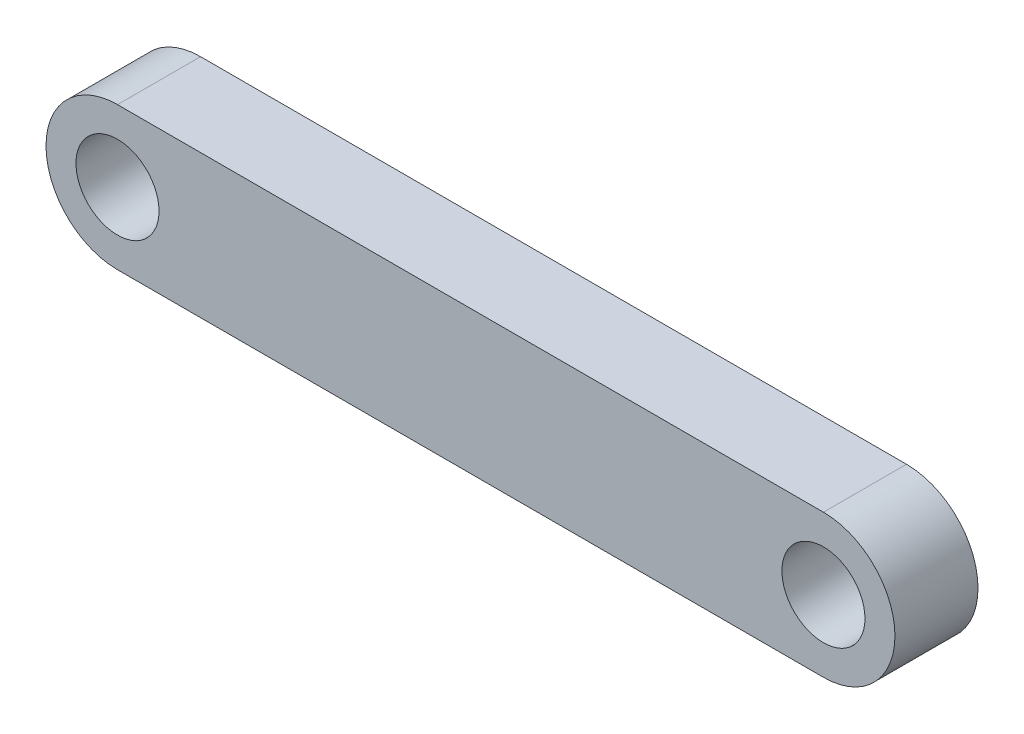
from build123d import *

# Parameters (mm, degrees)
SKETCH1_R           = 1
BOSS_EXTRUDE1_DEPTH = 2


with BuildPart() as part:
    # Sketch1 → Boss-Extrude1 (new body)
    with BuildSketch(Plane.XY):
        with BuildLine():
            Line((-8.909967846, 1.721864952), (8.090032154, 1.721864952))
            ThreePointArc((8.090032154, 1.721864952), (9.811897106, 0), (8.090032154, -1.721864952))
            Line((8.090032154, -1.721864952), (-8.909967846, -1.721864952))
            ThreePointArc((-8.909967846, -1.721864952), (-10.631832797, 0), (-8.909967846, 1.721864952))
        make_face()
        with Locations((8.090032154, 0)):
            Circle(SKETCH1_R, mode=Mode.SUBTRACT)
        with Locations((-8.909967846, 0)):
            Circle(SKETCH1_R, mode=Mode.SUBTRACT)
    extrude(amount=BOSS_EXTRUDE1_DEPTH)


solid = part.part
